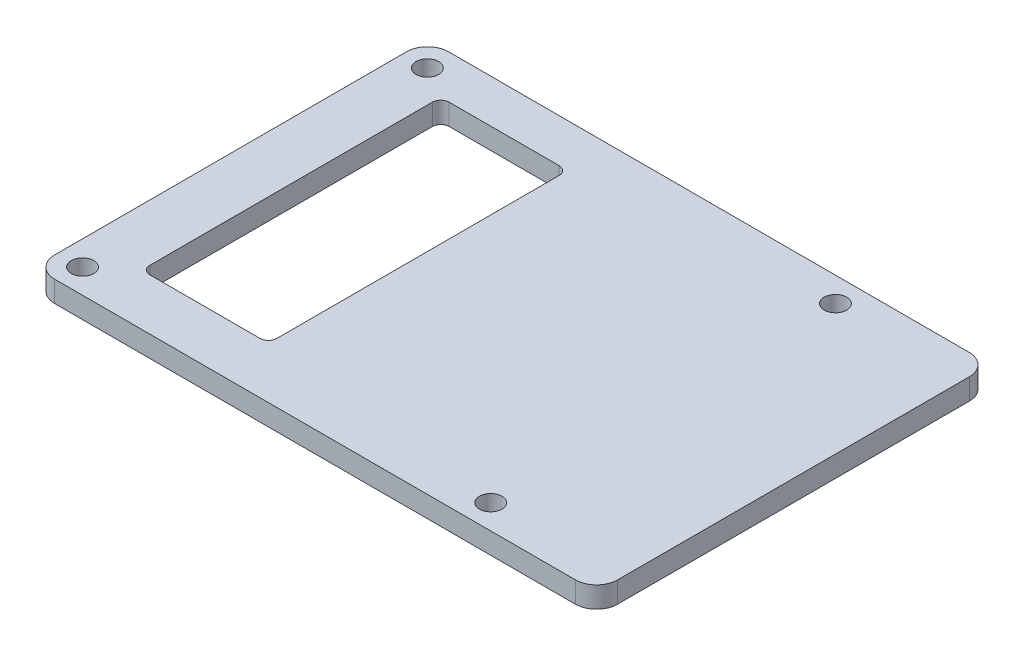
from build123d import *

# Parameters (mm, degrees)
SKETCH_1_R      = 1.6
EXTRUDE_1_DEPTH = 3


with BuildPart() as part:
    # 草图1 → 凸台-拉伸1 (new body)
    with BuildSketch(Plane(origin=(0, 0, 0), x_dir=(1, 0, 0), z_dir=(0, 1, 0))):
        with BuildLine():
            Line((-0.009028181, 21.389975432), (-0.009028181, -28.591736531))
            ThreePointArc((-0.009028181, -28.591736531), (-0.887707838, -30.713056875), (-3.009028181, -31.591736531))
            Line((-3.009028181, -31.591736531), (-77.021723127, -31.591736531))
            ThreePointArc((-77.021723127, -31.591736531), (-79.134066788, -30.716775138), (-80.009028181, -28.604431477))
            Line((-80.009028181, -28.604431477), (-80.009028181, 21.402670377))
            ThreePointArc((-80.009028181, 21.402670377), (-79.134066788, 23.515014039), (-77.021723127, 24.389975432))
            Line((-77.021723127, 24.389975432), (-3.009028181, 24.389975432))
            ThreePointArc((-3.009028181, 24.389975432), (-0.887707838, 23.511295776), (-0.009028181, 21.389975432))
        make_face()
        with Locations(Location((-76.52848462, 20.886724226, 0), (0, 0, 270))):
            Circle(SKETCH_1_R, mode=Mode.SUBTRACT)
        with Locations(Location((-18.52858622, 20.886597225, 0), (0, 0, 270))):
            Circle(SKETCH_1_R, mode=Mode.SUBTRACT)
        with Locations(Location((-18.52833222, -28.113656775, 0), (0, 0, 270))):
            Circle(SKETCH_1_R, mode=Mode.SUBTRACT)
        with Locations(Location((-76.52833222, -28.113529775, 0), (0, 0, 270))):
            Circle(SKETCH_1_R, mode=Mode.SUBTRACT)
        with BuildLine():
            Line((-70.770059731, 18.230282987), (-55.140568984, 18.230282987))
            ThreePointArc((-55.140568984, 18.230282987), (-54.292040846, 17.878811124), (-53.940568984, 17.030282987))
            Line((-53.940568984, 17.030282987), (-53.940568984, -23.088422311))
            ThreePointArc((-53.940568984, -23.088422311), (-54.292040846, -23.936950448), (-55.140568984, -24.288422311))
            Line((-55.140568984, -24.288422311), (-70.770059731, -24.288422311))
            ThreePointArc((-70.770059731, -24.288422311), (-71.618587868, -23.936950448), (-71.970059731, -23.088422311))
            Line((-71.970059731, -23.088422311), (-71.970059731, 17.030282987))
            ThreePointArc((-71.970059731, 17.030282987), (-71.618587868, 17.878811124), (-70.770059731, 18.230282987))
        make_face(mode=Mode.SUBTRACT)
    extrude(amount=EXTRUDE_1_DEPTH)


solid = part.part
